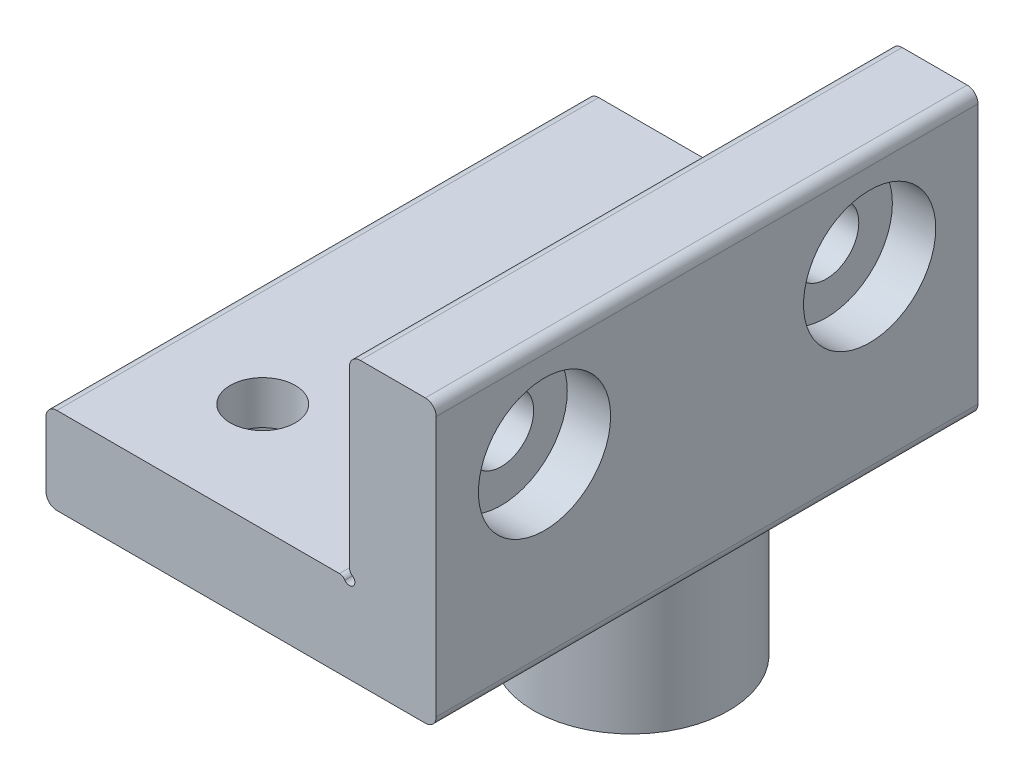
from build123d import *

# Parameters (mm, degrees)
BOSS_EXTRUDE1_DEPTH = 25
CUT_EXTRUDE1_REACH  = 33.464
SKETCH2_R           = 1.5
CUT_EXTRUDE2_REACH  = 34.094
SKETCH3_R           = 1.5
CUT_EXTRUDE3_REACH  = 32.033
SKETCH5_R           = 0.25
FILLET1_R           = 0.3
SKETCH6_R           = 3.05
CUT_EXTRUDE4_DEPTH  = 2
SKETCH7_R           = 3.05
CUT_EXTRUDE5_DEPTH  = 2
SKETCH9_R           = 4.5
BOSS_EXTRUDE2_DEPTH = 10.5
SKETCH10_R          = 0.75
CUT_EXTRUDE6_DEPTH  = 10.5
FILLET2_R           = 0.5


with BuildPart() as part:
    # Sketch1 → Boss-Extrude1 (new body)
    with BuildSketch(Plane.XY):
        Polygon((0, 0), (-14, 0), (-14, -4), (4, -4), (4, 9), (0, 9), align=None)
    extrude(amount=BOSS_EXTRUDE1_DEPTH)

    # Sketch2 → Cut-Extrude1 (cut, up to next)
    with BuildSketch(Plane.XZ.offset(4), mode=Mode.PRIVATE) as cut_extrude1_sk1:
        with Locations(Location((-9, 20, 0), (0, 0, 270))):
            Circle(SKETCH2_R)
    cut_extrude1_tool1 = extrude(cut_extrude1_sk1.sketch, amount=-CUT_EXTRUDE1_REACH, mode=Mode.PRIVATE) & part.part
    add(cut_extrude1_tool1.solids().sort_by_distance((-9, -4, 20))[0], mode=Mode.SUBTRACT)

    # Sketch3 → Cut-Extrude2 (cut, up to next)
    with BuildSketch(Plane(origin=(4, 0, 0), x_dir=(0, 0, -1), z_dir=(1, 0, 0)), mode=Mode.PRIVATE) as cut_extrude2_sk1:
        with Locations(Location((-5, 4.5, 0), (0, 0, 90))):
            Circle(SKETCH3_R)
    cut_extrude2_tool1 = extrude(cut_extrude2_sk1.sketch, amount=-CUT_EXTRUDE2_REACH, mode=Mode.PRIVATE) & part.part
    # Sketch3 → Cut-Extrude2 (cut, up to next)
    with BuildSketch(Plane(origin=(4, 0, 0), x_dir=(0, 0, -1), z_dir=(1, 0, 0)), mode=Mode.PRIVATE) as cut_extrude2_sk2:
        with Locations(Location((-20, 4.5, 0), (0, 0, 90))):
            Circle(SKETCH3_R)
    cut_extrude2_tool2 = extrude(cut_extrude2_sk2.sketch, amount=-CUT_EXTRUDE2_REACH, mode=Mode.PRIVATE) & part.part
    add(cut_extrude2_tool1.solids().sort_by_distance((4, 4.5, 5))[0], mode=Mode.SUBTRACT)
    add(cut_extrude2_tool2.solids().sort_by_distance((4, 4.5, 20))[0], mode=Mode.SUBTRACT)

    # Sketch5 → Cut-Extrude3 (cut, up to next)
    with BuildSketch(Plane.XY.offset(25), mode=Mode.PRIVATE) as cut_extrude3_sk1:
        Circle(SKETCH5_R)
    cut_extrude3_tool1 = extrude(cut_extrude3_sk1.sketch, amount=-CUT_EXTRUDE3_REACH, mode=Mode.PRIVATE) & part.part
    add(cut_extrude3_tool1.solids().sort_by_distance((0, 0, 25))[0], mode=Mode.SUBTRACT)

    # Fillet1
    fillet1_edges = [part.edges().sort_by_distance(p)[0] for p in [
        (0, 0.25, 12.5),
        (-0.25, 0, 12.5),
    ]]
    fillet(fillet1_edges, radius=FILLET1_R)

    # Sketch6 → Cut-Extrude4 (cut)
    with BuildSketch(Plane(origin=(4, 0, 0), x_dir=(0, 0, -1), z_dir=(1, 0, 0))):
        with Locations((-20, 4.5)):
            Circle(SKETCH6_R)
        with Locations((-5, 4.5)):
            Circle(SKETCH6_R)
    extrude(amount=-CUT_EXTRUDE4_DEPTH, mode=Mode.SUBTRACT)

    # Sketch7 → Cut-Extrude5 (cut)
    with BuildSketch(Plane.XZ.offset(4)):
        with Locations(Location((-9, 20, 0), (0, 0, 270))):
            Circle(SKETCH7_R)
    extrude(amount=-CUT_EXTRUDE5_DEPTH, mode=Mode.SUBTRACT)

    # Sketch9 → Boss-Extrude2 (add)
    with BuildSketch(Plane.XZ.offset(4)):
        with Locations(Location((-5, 7, 0), (0, 0, 90))):
            Circle(SKETCH9_R)
    extrude(amount=BOSS_EXTRUDE2_DEPTH)

    # Sketch10 → Cut-Extrude6 (cut)
    with BuildSketch(Plane.XZ.offset(14.5)):
        with Locations(Location((-5, 7, 0), (0, 0, 270))):
            Circle(SKETCH10_R)
    extrude(amount=-CUT_EXTRUDE6_DEPTH, mode=Mode.SUBTRACT)

    # Fillet2
    fillet2_edges = [part.edges().sort_by_distance(p)[0] for p in [
        (0, 9, 12.5),
        (4, 9, 12.5),
        (4, -4, 12.5),
        (-14, -4, 12.5),
        (-14, 0, 12.5),
    ]]
    fillet(fillet2_edges, radius=FILLET2_R)


solid = part.part
